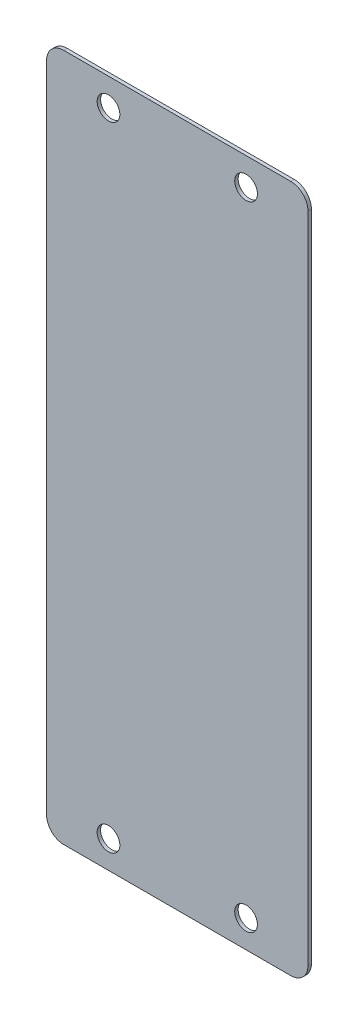
from build123d import *

# Parameters (mm, degrees)
SKETCH_1_W          = 76
SKETCH_1_H          = 200
EXTRUDE_1_DEPTH     = 1
SKETCH_2_R          = 3.3
CUT_EXTRUDE_1_DEPTH = 107.981306778
FILLET_1_R          = 5


with BuildPart() as part:
    # 草图1 → 凸台-拉伸1 (new body)
    with BuildSketch(Plane.XY):
        Rectangle(SKETCH_1_W, SKETCH_1_H)
    extrude(amount=EXTRUDE_1_DEPTH)

    # 草图2 → 切除-拉伸1 (cut, through all)
    with BuildSketch(Plane.XY.offset(1)):
        with Locations((-20, 92)):
            Circle(SKETCH_2_R)
        with Locations((20, 92)):
            Circle(SKETCH_2_R)
        with Locations((-20, -92)):
            Circle(SKETCH_2_R)
        with Locations((20, -92)):
            Circle(SKETCH_2_R)
    extrude(amount=-CUT_EXTRUDE_1_DEPTH, mode=Mode.SUBTRACT)

    # 圆角1
    fillet_1_edges = [part.edges().sort_by_distance(p)[0] for p in [
        (38, -100, 0.5),
        (-38, -100, 0.5),
        (-38, 100, 0.5),
        (38, 100, 0.5),
    ]]
    fillet(fillet_1_edges, radius=FILLET_1_R)


solid = part.part
